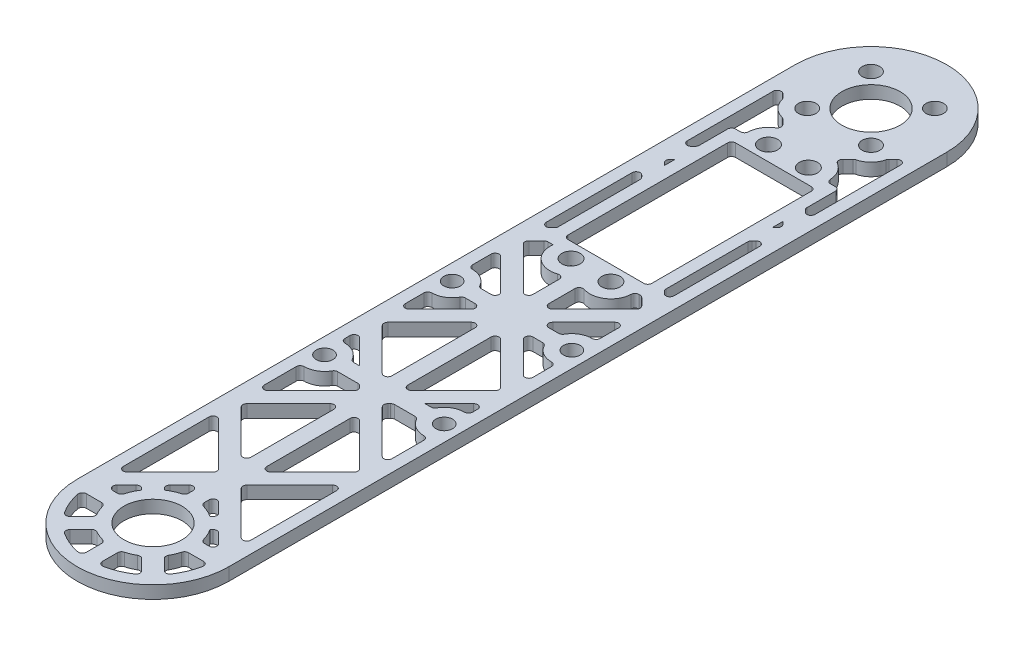
from build123d import *

# Parameters (mm, degrees)
SKETCH1_R           = 7.3
SKETCH1_R_2         = 2.2
SKETCH1_R_3         = 2.3
SKETCH1_R_4         = 2.1
SKETCH1_W           = 21
SKETCH1_H           = 42
BOSS_EXTRUDE2_DEPTH = 3.175
CUT_EXTRUDE1_DEPTH  = 3.175
FILLET1_R           = 1


with BuildPart() as part:
    # Sketch1 → Boss-Extrude2 (new body)
    with BuildSketch(Plane(origin=(0, 0, 0), x_dir=(1, 0, 0), z_dir=(0, 1, 0))):
        with BuildLine():
            Line((-19, 90), (-19, -90))
            ThreePointArc((-19, -90), (0, -109), (19, -90))
            Line((19, -90), (19, 90))
            ThreePointArc((19, 90), (0, 109), (-19, 90))
        make_face()
        with Locations(Location((0, 90, 0), (0, 0, 270))):
            Circle(SKETCH1_R, mode=Mode.SUBTRACT)
        with Locations(Location((0, -90, 0), (0, 0, 270))):
            Circle(SKETCH1_R, mode=Mode.SUBTRACT)
        with Locations(Location((-8, 98, 0), (0, 0, 270))):
            Circle(SKETCH1_R_2, mode=Mode.SUBTRACT)
        with Locations(Location((8, 98, 0), (0, 0, 270))):
            Circle(SKETCH1_R_2, mode=Mode.SUBTRACT)
        with Locations(Location((-8, 82, 0), (0, 0, 270))):
            Circle(SKETCH1_R_2, mode=Mode.SUBTRACT)
        with Locations(Location((8, 82, 0), (0, 0, 270))):
            Circle(SKETCH1_R_2, mode=Mode.SUBTRACT)
        with Locations(Location((-5, 69.295169646, 0), (0, 0, 270))):
            Circle(SKETCH1_R_3, mode=Mode.SUBTRACT)
        with Locations(Location((5, 69.295169646, 0), (0, 0, 270))):
            Circle(SKETCH1_R_3, mode=Mode.SUBTRACT)
        with Locations(Location((5, 19.795169646, 0), (0, 0, 270))):
            Circle(SKETCH1_R_3, mode=Mode.SUBTRACT)
        with Locations(Location((-5, 19.795169646, 0), (0, 0, 270))):
            Circle(SKETCH1_R_3, mode=Mode.SUBTRACT)
        with Locations(Location((15, 0, 0), (0, 0, 270))):
            Circle(SKETCH1_R_4, mode=Mode.SUBTRACT)
        with Locations(Location((15, -32, 0), (0, 0, 270))):
            Circle(SKETCH1_R_4, mode=Mode.SUBTRACT)
        with Locations(Location((-15, 0, 0), (0, 0, 270))):
            Circle(SKETCH1_R_4, mode=Mode.SUBTRACT)
        with Locations(Location((-15, -32, 0), (0, 0, 270))):
            Circle(SKETCH1_R_4, mode=Mode.SUBTRACT)
        with Locations((0, 44.545169646)):
            Rectangle(SKETCH1_W, SKETCH1_H, mode=Mode.SUBTRACT)
    extrude(amount=BOSS_EXTRUDE2_DEPTH)

    # Sketch2 → Cut-Extrude1 (cut)
    with BuildSketch(Plane(origin=(0, 3.175, 0), x_dir=(1, 0, 0), z_dir=(0, 1, 0))):
        with BuildLine():
            Line((16, 59.953318806), (16, 81.468037432))
            ThreePointArc((16, 81.468037432), (15.382683432, 82.391916964), (14.292893219, 82.175144213))
            Line((14.292893219, 82.175144213), (13.303286445, 81.185537439))
            ThreePointArc((13.303286445, 81.185537439), (13.140925564, 80.97242052), (13.040974964, 80.723845068))
            ThreePointArc((13.040974964, 80.723845068), (11.676955262, 78.323044738), (9.276154932, 76.959025036))
            ThreePointArc((9.276154932, 76.959025036), (9.02757948, 76.859074436), (8.814462561, 76.696713555))
            Line((8.814462561, 76.696713555), (7.526721054, 75.408972048))
            ThreePointArc((7.526721054, 75.408972048), (7.241405245, 74.578993779), (7.720521829, 73.843659612))
            ThreePointArc((7.720521829, 73.843659612), (9.557454428, 72.000647263), (10.29582539, 69.505487106))
            ThreePointArc((10.29582539, 69.505487106), (10.602102861, 68.824169459), (11.295037728, 68.545169646))
            Line((11.295037728, 68.545169646), (12.5, 68.545169646))
            ThreePointArc((12.5, 68.545169646), (13.207106781, 68.252276427), (13.5, 67.545169646))
            Line((13.5, 67.545169646), (13.5, 60.453318806))
            ThreePointArc((13.5, 60.453318806), (13.576120468, 60.070635373), (13.792893219, 59.746212024))
            Line((13.792893219, 59.746212024), (14.292893219, 59.246212024))
            ThreePointArc((14.292893219, 59.246212024), (15.382683432, 59.029439273), (16, 59.953318806))
        make_face()
        with BuildLine():
            Line((2, 13.821058833), (2, 7.242640687))
            ThreePointArc((2, 7.242640687), (2.617316568, 6.318761155), (3.707106781, 6.535533906))
            Line((3.707106781, 6.535533906), (14.142135624, 16.970562748))
            ThreePointArc((14.142135624, 16.970562748), (14.435028843, 17.67766953), (14.142135624, 18.384776311))
            Line((14.142135624, 18.384776311), (12.274635508, 20.252276427))
            ThreePointArc((12.274635508, 20.252276427), (11.950212159, 20.469049178), (11.567528726, 20.545169646))
            Line((11.567528726, 20.545169646), (11.295037728, 20.545169646))
            ThreePointArc((11.295037728, 20.545169646), (10.602102861, 20.266169833), (10.29582539, 19.584852185))
            ThreePointArc((10.29582539, 19.584852185), (8.010194502, 15.432976498), (3.317460317, 14.769330391))
            ThreePointArc((3.317460317, 14.769330391), (2.415816945, 14.632680764), (2, 13.821058833))
        make_face()
        with BuildLine():
            Line((16, -10.757359313), (16, -6.1))
            ThreePointArc((16, -6.1), (15.707106781, -5.392893219), (15, -5.1))
            ThreePointArc((15, -5.1), (12.429183328, -4.404645461), (10.559397653, -2.508196721))
            ThreePointArc((10.559397653, -2.508196721), (10.19277301, -2.136344027), (9.68869131, -2))
            Line((9.68869131, -2), (7.242640687, -2))
            ThreePointArc((7.242640687, -2), (6.318761155, -2.617316568), (6.535533906, -3.707106781))
            Line((6.535533906, -3.707106781), (14.292893219, -11.464466094))
            ThreePointArc((14.292893219, -11.464466094), (15.382683432, -11.681238845), (16, -10.757359313))
        make_face()
        with BuildLine():
            Line((16, 10.757359313), (16, 6.1))
            ThreePointArc((16, 6.1), (15.707106781, 5.392893219), (15, 5.1))
            ThreePointArc((15, 5.1), (12.429183328, 4.404645461), (10.559397653, 2.508196721))
            ThreePointArc((10.559397653, 2.508196721), (10.19277301, 2.136344027), (9.68869131, 2))
            Line((9.68869131, 2), (7.242640687, 2))
            ThreePointArc((7.242640687, 2), (6.318761155, 2.617316568), (6.535533906, 3.707106781))
            Line((6.535533906, 3.707106781), (14.292893219, 11.464466094))
            ThreePointArc((14.292893219, 11.464466094), (15.382683432, 11.681238845), (16, 10.757359313))
        make_face()
        with BuildLine():
            Line((2, -7.242640687), (2, -28.112698372))
            ThreePointArc((2, -28.112698372), (2.617316568, -29.036577905), (3.707106781, -28.819805153))
            Line((3.707106781, -28.819805153), (14.142135624, -18.384776311))
            ThreePointArc((14.142135624, -18.384776311), (14.435028843, -17.67766953), (14.142135624, -16.970562748))
            Line((14.142135624, -16.970562748), (3.707106781, -6.535533906))
            ThreePointArc((3.707106781, -6.535533906), (2.617316568, -6.318761155), (2, -7.242640687))
        make_face()
        with BuildLine():
            Line((2, -42.597979747), (2, -63.468037432))
            ThreePointArc((2, -63.468037432), (2.617316568, -64.391916964), (3.707106781, -64.175144213))
            Line((3.707106781, -64.175144213), (14.142135624, -53.74011537))
            ThreePointArc((14.142135624, -53.74011537), (14.435028843, -53.033008589), (14.142135624, -52.325901808))
            Line((14.142135624, -52.325901808), (3.707106781, -41.890872965))
            ThreePointArc((3.707106781, -41.890872965), (2.617316568, -41.674100214), (2, -42.597979747))
        make_face()
        with BuildLine():
            Line((16, -59.953318806), (16, -81.468037431))
            ThreePointArc((16, -81.468037431), (15.382683432, -82.391916964), (14.292893219, -82.175144213))
            Line((14.292893219, -82.175144213), (3.535533906, -71.4177849))
            ThreePointArc((3.535533906, -71.4177849), (3.242640687, -70.710678119), (3.535533906, -70.003571337))
            Line((3.535533906, -70.003571337), (14.292893219, -59.246212025))
            ThreePointArc((14.292893219, -59.246212025), (15.382683432, -59.029439273), (16, -59.953318806))
        make_face()
        with BuildLine():
            Line((2, -77.953318806), (2, -79.105505978))
            ThreePointArc((2, -79.105505978), (2.204548328, -79.711523005), (2.734513274, -80.069620493))
            ThreePointArc((2.734513274, -80.069620493), (4.287639599, -80.634844013), (5.730364802, -81.441208074))
            Line((5.730364802, -81.441208074), (6.109127035, -81.062445841))
            ThreePointArc((6.109127035, -81.062445841), (6.402020254, -80.355339059), (6.109127035, -79.648232278))
            Line((6.109127035, -79.648232278), (3.707106781, -77.246212025))
            ThreePointArc((3.707106781, -77.246212025), (2.617316568, -77.029439273), (2, -77.953318806))
        make_face()
        with BuildLine():
            Line((8.937554159, -83.890872965), (8.558791926, -84.269635198))
            ThreePointArc((8.558791926, -84.269635198), (9.365155987, -85.712360401), (9.930379507, -87.265486726))
            ThreePointArc((9.930379507, -87.265486726), (10.288476995, -87.795451672), (10.894494022, -88))
            Line((10.894494022, -88), (12.046681194, -88))
            ThreePointArc((12.046681194, -88), (12.970560727, -87.382683432), (12.753787975, -86.292893219))
            Line((12.753787975, -86.292893219), (10.351767722, -83.890872965))
            ThreePointArc((10.351767722, -83.890872965), (9.644660941, -83.597979746), (8.937554159, -83.890872965))
        make_face()
        with BuildLine():
            Line((9.117784163, -96.289357038), (11.806518408, -98.978091283))
            ThreePointArc((11.806518408, -98.978091283), (12.614134151, -99.265920655), (13.347866868, -98.822383469))
            ThreePointArc((13.347866868, -98.822383469), (14.78207252, -96.122934918), (15.676734354, -93.2))
            ThreePointArc((15.676734354, -93.2), (15.471535126, -92.367544468), (14.696938457, -92))
            Line((14.696938457, -92), (10.894494022, -92))
            ThreePointArc((10.894494022, -92), (10.288476995, -92.204548328), (9.930379507, -92.734513274))
            ThreePointArc((9.930379507, -92.734513274), (9.515959185, -93.941639353), (8.955431569, -95.08824581))
            ThreePointArc((8.955431569, -95.08824581), (8.833902923, -95.716200779), (9.117784163, -96.289357038))
        make_face()
        with BuildLine():
            Line((2, -100.894494022), (2, -104.696938457))
            ThreePointArc((2, -104.696938457), (2.367544468, -105.471535126), (3.2, -105.676734354))
            ThreePointArc((3.2, -105.676734354), (6.122934918, -104.78207252), (8.822383469, -103.347866868))
            ThreePointArc((8.822383469, -103.347866868), (9.265920655, -102.614134151), (8.978091283, -101.806518408))
            Line((8.978091283, -101.806518408), (6.289357038, -99.117784163))
            ThreePointArc((6.289357038, -99.117784163), (5.716200779, -98.833902923), (5.08824581, -98.955431569))
            ThreePointArc((5.08824581, -98.955431569), (3.941639353, -99.515959185), (2.734513274, -99.930379507))
            ThreePointArc((2.734513274, -99.930379507), (2.204548328, -100.288476995), (2, -100.894494022))
        make_face()
        with BuildLine():
            Line((-2, 13.821058833), (-2, 7.242640687))
            ThreePointArc((-2, 7.242640687), (-2.617316568, 6.318761155), (-3.707106781, 6.535533906))
            Line((-3.707106781, 6.535533906), (-14.142135624, 16.970562748))
            ThreePointArc((-14.142135624, 16.970562748), (-14.435028843, 17.67766953), (-14.142135624, 18.384776311))
            Line((-14.142135624, 18.384776311), (-12.274635508, 20.252276427))
            ThreePointArc((-12.274635508, 20.252276427), (-11.950212159, 20.469049178), (-11.567528726, 20.545169646))
            Line((-11.567528726, 20.545169646), (-10.246665608, 20.545169646))
            ThreePointArc((-10.246665608, 20.545169646), (-8.393497927, 15.724030761), (-3.317460317, 14.769330391))
            ThreePointArc((-3.317460317, 14.769330391), (-2.415816945, 14.632680764), (-2, 13.821058833))
        make_face()
        with BuildLine():
            Line((-3.707106781, -28.819805153), (-14.142135624, -18.384776311))
            ThreePointArc((-14.142135624, -18.384776311), (-14.435028843, -17.67766953), (-14.142135624, -16.970562748))
            Line((-14.142135624, -16.970562748), (-3.707106781, -6.535533906))
            ThreePointArc((-3.707106781, -6.535533906), (-2.617316568, -6.318761155), (-2, -7.242640687))
            Line((-2, -7.242640687), (-2, -28.112698372))
            ThreePointArc((-2, -28.112698372), (-2.617316568, -29.036577905), (-3.707106781, -28.819805153))
        make_face()
        with BuildLine():
            Line((-2, -42.597979747), (-2, -63.468037432))
            ThreePointArc((-2, -63.468037432), (-2.617316568, -64.391916964), (-3.707106781, -64.175144213))
            Line((-3.707106781, -64.175144213), (-14.142135624, -53.74011537))
            ThreePointArc((-14.142135624, -53.74011537), (-14.435028843, -53.033008589), (-14.142135624, -52.325901808))
            Line((-14.142135624, -52.325901808), (-3.707106781, -41.890872965))
            ThreePointArc((-3.707106781, -41.890872965), (-2.617316568, -41.674100214), (-2, -42.597979747))
        make_face()
        with BuildLine():
            Line((-14.292893219, -82.175144213), (-3.535533906, -71.4177849))
            ThreePointArc((-3.535533906, -71.4177849), (-3.242640687, -70.710678119), (-3.535533906, -70.003571337))
            Line((-3.535533906, -70.003571337), (-14.292893219, -59.246212025))
            ThreePointArc((-14.292893219, -59.246212025), (-15.382683432, -59.029439273), (-16, -59.953318806))
            Line((-16, -59.953318806), (-16, -81.468037431))
            ThreePointArc((-16, -81.468037431), (-15.382683432, -82.391916964), (-14.292893219, -82.175144213))
        make_face()
        with BuildLine():
            Line((-2, -77.953318806), (-2, -79.105505978))
            ThreePointArc((-2, -79.105505978), (-2.204548328, -79.711523005), (-2.734513274, -80.069620493))
            ThreePointArc((-2.734513274, -80.069620493), (-4.287639599, -80.634844013), (-5.730364802, -81.441208074))
            Line((-5.730364802, -81.441208074), (-6.109127035, -81.062445841))
            ThreePointArc((-6.109127035, -81.062445841), (-6.402020254, -80.355339059), (-6.109127035, -79.648232278))
            Line((-6.109127035, -79.648232278), (-3.707106781, -77.246212025))
            ThreePointArc((-3.707106781, -77.246212025), (-2.617316568, -77.029439273), (-2, -77.953318806))
        make_face()
        with BuildLine():
            Line((-2, -100.894494022), (-2, -104.696938457))
            ThreePointArc((-2, -104.696938457), (-2.367544468, -105.471535126), (-3.2, -105.676734354))
            ThreePointArc((-3.2, -105.676734354), (-6.122934918, -104.78207252), (-8.822383469, -103.347866868))
            ThreePointArc((-8.822383469, -103.347866868), (-9.265920655, -102.614134151), (-8.978091283, -101.806518408))
            Line((-8.978091283, -101.806518408), (-6.289357038, -99.117784163))
            ThreePointArc((-6.289357038, -99.117784163), (-5.716200779, -98.833902923), (-5.08824581, -98.955431569))
            ThreePointArc((-5.08824581, -98.955431569), (-3.941639353, -99.515959185), (-2.734513274, -99.930379507))
            ThreePointArc((-2.734513274, -99.930379507), (-2.204548328, -100.288476995), (-2, -100.894494022))
        make_face()
        with BuildLine():
            Line((-7.242640687, -2), (-9.68869131, -2))
            ThreePointArc((-9.68869131, -2), (-10.19277301, -2.136344027), (-10.559397653, -2.508196721))
            ThreePointArc((-10.559397653, -2.508196721), (-12.429183328, -4.404645461), (-15, -5.1))
            ThreePointArc((-15, -5.1), (-15.707106781, -5.392893219), (-16, -6.1))
            Line((-16, -6.1), (-16, -10.757359313))
            ThreePointArc((-16, -10.757359313), (-15.382683432, -11.681238845), (-14.292893219, -11.464466094))
            Line((-14.292893219, -11.464466094), (-6.535533906, -3.707106781))
            ThreePointArc((-6.535533906, -3.707106781), (-6.318761155, -2.617316568), (-7.242640687, -2))
        make_face()
        with BuildLine():
            Line((-16, 10.757359313), (-16, 6.1))
            ThreePointArc((-16, 6.1), (-15.707106781, 5.392893219), (-15, 5.1))
            ThreePointArc((-15, 5.1), (-12.429183328, 4.404645461), (-10.559397653, 2.508196721))
            ThreePointArc((-10.559397653, 2.508196721), (-10.19277301, 2.136344027), (-9.68869131, 2))
            Line((-9.68869131, 2), (-7.242640687, 2))
            ThreePointArc((-7.242640687, 2), (-6.318761155, 2.617316568), (-6.535533906, 3.707106781))
            Line((-6.535533906, 3.707106781), (-14.292893219, 11.464466094))
            ThreePointArc((-14.292893219, 11.464466094), (-15.382683432, 11.681238845), (-16, 10.757359313))
        make_face()
        with BuildLine():
            Line((13.792893219, 46.319805153), (14.292893219, 46.819805153))
            ThreePointArc((14.292893219, 46.819805153), (15.382683432, 47.036577905), (16, 46.112698372))
            Line((16, 46.112698372), (16, 24.597979746))
            ThreePointArc((16, 24.597979746), (15.382683432, 23.674100214), (14.292893219, 23.890872965))
            Line((14.292893219, 23.890872965), (13.792893219, 24.390872965))
            ThreePointArc((13.792893219, 24.390872965), (13.576120468, 24.715296314), (13.5, 25.097979746))
            Line((13.5, 25.097979746), (13.5, 45.612698372))
            ThreePointArc((13.5, 45.612698372), (13.576120467, 45.995381805), (13.792893219, 46.319805153))
        make_face()
        with BuildLine():
            Line((13.5, 54.382250994), (14.142135624, 53.74011537))
            ThreePointArc((14.142135624, 53.74011537), (14.435028843, 53.033008589), (14.142135624, 52.325901808))
            Line((14.142135624, 52.325901808), (13.5, 51.683766184))
            Line((13.5, 51.683766184), (13.5, 54.382250994))
        make_face()
        with BuildLine():
            Line((-14.292893219, 23.890872965), (-13.792893219, 24.390872965))
            ThreePointArc((-13.792893219, 24.390872965), (-13.576120468, 24.715296314), (-13.5, 25.097979746))
            Line((-13.5, 25.097979746), (-13.5, 45.612698372))
            ThreePointArc((-13.5, 45.612698372), (-13.576120467, 45.995381805), (-13.792893219, 46.319805153))
            Line((-13.792893219, 46.319805153), (-14.292893219, 46.819805153))
            ThreePointArc((-14.292893219, 46.819805153), (-15.382683432, 47.036577905), (-16, 46.112698372))
            Line((-16, 46.112698372), (-16, 24.597979746))
            ThreePointArc((-16, 24.597979746), (-15.382683432, 23.674100214), (-14.292893219, 23.890872965))
        make_face()
        with BuildLine():
            Line((-14.142135624, 52.325901808), (-13.5, 51.683766184))
            Line((-13.5, 51.683766184), (-13.5, 54.382250994))
            Line((-13.5, 54.382250994), (-14.142135624, 53.74011537))
            ThreePointArc((-14.142135624, 53.74011537), (-14.435028843, 53.033008589), (-14.142135624, 52.325901808))
        make_face()
        with BuildLine():
            Line((-13.792893219, 59.746212024), (-14.292893219, 59.246212024))
            ThreePointArc((-14.292893219, 59.246212024), (-15.382683432, 59.029439273), (-16, 59.953318806))
            Line((-16, 59.953318806), (-16, 81.468037432))
            ThreePointArc((-16, 81.468037432), (-15.382683432, 82.391916964), (-14.292893219, 82.175144213))
            Line((-14.292893219, 82.175144213), (-13.303286445, 81.185537439))
            ThreePointArc((-13.303286445, 81.185537439), (-13.140925564, 80.97242052), (-13.040974964, 80.723845068))
            ThreePointArc((-13.040974964, 80.723845068), (-11.676955262, 78.323044738), (-9.276154932, 76.959025036))
            ThreePointArc((-9.276154932, 76.959025036), (-9.02757948, 76.859074436), (-8.814462561, 76.696713555))
            Line((-8.814462561, 76.696713555), (-7.526721054, 75.408972048))
            ThreePointArc((-7.526721054, 75.408972048), (-7.241405245, 74.578993779), (-7.720521829, 73.843659612))
            ThreePointArc((-7.720521829, 73.843659612), (-9.557454428, 72.000647263), (-10.29582539, 69.505487106))
            ThreePointArc((-10.29582539, 69.505487106), (-10.602102861, 68.824169459), (-11.295037728, 68.545169646))
            Line((-11.295037728, 68.545169646), (-12.5, 68.545169646))
            ThreePointArc((-12.5, 68.545169646), (-13.207106781, 68.252276427), (-13.5, 67.545169646))
            Line((-13.5, 67.545169646), (-13.5, 60.453318806))
            ThreePointArc((-13.5, 60.453318806), (-13.576120468, 60.070635373), (-13.792893219, 59.746212024))
        make_face()
        with BuildLine():
            Line((-10.894494022, -92), (-14.696938457, -92))
            ThreePointArc((-14.696938457, -92), (-15.471535126, -92.367544468), (-15.676734354, -93.2))
            ThreePointArc((-15.676734354, -93.2), (-14.78207252, -96.122934918), (-13.347866868, -98.822383469))
            ThreePointArc((-13.347866868, -98.822383469), (-12.614134151, -99.265920655), (-11.806518408, -98.978091283))
            Line((-11.806518408, -98.978091283), (-9.117784163, -96.289357038))
            ThreePointArc((-9.117784163, -96.289357038), (-8.833902923, -95.716200779), (-8.955431569, -95.08824581))
            ThreePointArc((-8.955431569, -95.08824581), (-9.515959185, -93.941639353), (-9.930379507, -92.734513274))
            ThreePointArc((-9.930379507, -92.734513274), (-10.288476995, -92.204548328), (-10.894494022, -92))
        make_face()
        with BuildLine():
            Line((-8.937554159, -83.890872965), (-8.558791926, -84.269635198))
            ThreePointArc((-8.558791926, -84.269635198), (-9.365155987, -85.712360401), (-9.930379507, -87.265486726))
            ThreePointArc((-9.930379507, -87.265486726), (-10.288476995, -87.795451672), (-10.894494022, -88))
            Line((-10.894494022, -88), (-12.046681194, -88))
            ThreePointArc((-12.046681194, -88), (-12.970560727, -87.382683432), (-12.753787975, -86.292893219))
            Line((-12.753787975, -86.292893219), (-10.351767722, -83.890872965))
            ThreePointArc((-10.351767722, -83.890872965), (-9.644660941, -83.597979746), (-8.937554159, -83.890872965))
        make_face()
        with BuildLine():
            Line((-16, -24.597979746), (-16, -25.9))
            ThreePointArc((-16, -25.9), (-15.707106781, -26.607106781), (-15, -26.9))
            ThreePointArc((-15, -26.9), (-12.429183328, -27.595354539), (-10.559397653, -29.491803279))
            ThreePointArc((-10.559397653, -29.491803279), (-10.19277301, -29.863655973), (-9.68869131, -30))
            Line((-9.68869131, -30), (-8.183766184, -30))
            Line((-8.183766184, -30), (-14.292893219, -23.890872965))
            ThreePointArc((-14.292893219, -23.890872965), (-15.382683432, -23.674100214), (-16, -24.597979746))
        make_face()
        with BuildLine():
            Line((-9.68869131, -34), (-4.597979746, -34))
            ThreePointArc((-4.597979746, -34), (-4.215296314, -34.076120468), (-3.890872965, -34.292893219))
            Line((-3.890872965, -34.292893219), (-3.535533906, -34.648232278))
            ThreePointArc((-3.535533906, -34.648232278), (-3.242640687, -35.355339059), (-3.535533906, -36.062445841))
            Line((-3.535533906, -36.062445841), (-14.292893219, -46.819805153))
            ThreePointArc((-14.292893219, -46.819805153), (-15.382683432, -47.036577905), (-16, -46.112698372))
            Line((-16, -46.112698372), (-16, -38.1))
            ThreePointArc((-16, -38.1), (-15.707106781, -37.392893219), (-15, -37.1))
            ThreePointArc((-15, -37.1), (-12.429183328, -36.404645461), (-10.559397653, -34.508196721))
            ThreePointArc((-10.559397653, -34.508196721), (-10.19277301, -34.136344027), (-9.68869131, -34))
        make_face()
        with BuildLine():
            Line((16, -24.597979746), (16, -25.9))
            ThreePointArc((16, -25.9), (15.707106781, -26.607106781), (15, -26.9))
            ThreePointArc((15, -26.9), (12.429183328, -27.595354539), (10.559397653, -29.491803279))
            ThreePointArc((10.559397653, -29.491803279), (10.19277301, -29.863655973), (9.68869131, -30))
            Line((9.68869131, -30), (8.183766184, -30))
            Line((8.183766184, -30), (14.292893219, -23.890872965))
            ThreePointArc((14.292893219, -23.890872965), (15.382683432, -23.674100214), (16, -24.597979746))
        make_face()
        with BuildLine():
            Line((16, -46.112698372), (16, -38.1))
            ThreePointArc((16, -38.1), (15.707106781, -37.392893219), (15, -37.1))
            ThreePointArc((15, -37.1), (12.429183328, -36.404645461), (10.559397653, -34.508196721))
            ThreePointArc((10.559397653, -34.508196721), (10.19277301, -34.136344027), (9.68869131, -34))
            Line((9.68869131, -34), (4.597979746, -34))
            ThreePointArc((4.597979746, -34), (4.215296314, -34.076120468), (3.890872965, -34.292893219))
            Line((3.890872965, -34.292893219), (3.535533906, -34.648232278))
            ThreePointArc((3.535533906, -34.648232278), (3.242640687, -35.355339059), (3.535533906, -36.062445841))
            Line((3.535533906, -36.062445841), (14.292893219, -46.819805153))
            ThreePointArc((14.292893219, -46.819805153), (15.382683432, -47.036577905), (16, -46.112698372))
        make_face()
    extrude(amount=-CUT_EXTRUDE1_DEPTH, mode=Mode.SUBTRACT)

    # Fillet1
    fillet1_edges = [part.edges().sort_by_distance(p)[0] for p in [
        (-10.5, 1.5875, -65.545169646),
        (-10.5, 1.5875, -23.545169646),
        (10.5, 1.5875, -23.545169646),
        (10.5, 1.5875, -65.545169646),
    ]]
    fillet(fillet1_edges, radius=FILLET1_R)


solid = part.part
